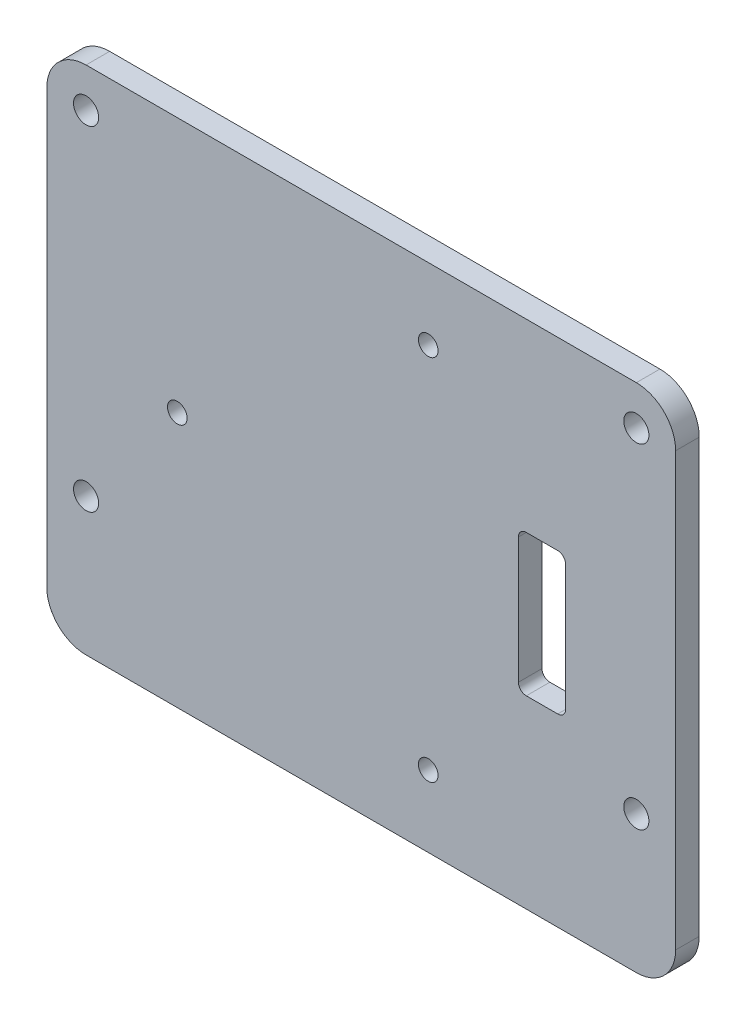
from build123d import *

# Parameters (mm, degrees)
SKETCH1_W           = 80
SKETCH1_H           = 65
SKETCH1_R           = 1.25
BOSS_EXTRUDE1_DEPTH = 3
FILLET1_R           = 5
SKETCH2_R           = 1.6
CUT_EXTRUDE1_DEPTH  = 52.626059311
SKETCH4_W           = 6
SKETCH4_H           = 18
CUT_EXTRUDE2_DEPTH  = 52.626059311
FILLET2_R           = 1


with BuildPart() as part:
    # Sketch1 → Boss-Extrude1 (new body)
    with BuildSketch(Plane.XY):
        Rectangle(SKETCH1_W, SKETCH1_H)
        with Locations((8.526833703, 23.400005474)):
            Circle(SKETCH1_R, mode=Mode.SUBTRACT)
        with Locations((8.526833703, -23.399994526)):
            Circle(SKETCH1_R, mode=Mode.SUBTRACT)
        with Locations((-23.393166297, 5.474e-06)):
            Circle(SKETCH1_R, mode=Mode.SUBTRACT)
    extrude(amount=BOSS_EXTRUDE1_DEPTH)

    # Fillet1
    fillet1_edges = [part.edges().sort_by_distance(p)[0] for p in [
        (-40, 32.5, 1.5),
        (40, 32.5, 1.5),
        (40, -32.5, 1.5),
        (-40, -32.5, 1.5),
    ]]
    fillet(fillet1_edges, radius=FILLET1_R)

    # Sketch2 → Cut-Extrude1 (cut, through all)
    with BuildSketch(Plane(origin=(0, 0, 0), x_dir=(-1, 0, 0), z_dir=(0, 0, -1))):
        with Locations((-35, 27.5)):
            Circle(SKETCH2_R)
        with Locations((-35, -15)):
            Circle(SKETCH2_R)
        with Locations((35, 27.5)):
            Circle(SKETCH2_R)
        with Locations((35, -15)):
            Circle(SKETCH2_R)
    extrude(amount=-CUT_EXTRUDE1_DEPTH, mode=Mode.SUBTRACT)

    # Sketch4 → Cut-Extrude2 (cut, through all)
    with BuildSketch(Plane(origin=(0, 0, 0), x_dir=(-1, 0, 0), z_dir=(0, 0, -1))):
        with Locations((-23, 0)):
            Rectangle(SKETCH4_W, SKETCH4_H)
    extrude(amount=-CUT_EXTRUDE2_DEPTH, mode=Mode.SUBTRACT)

    # Fillet2
    fillet2_edges = [part.edges().sort_by_distance(p)[0] for p in [
        (26, -9, 1.5),
        (26, 9, 1.5),
        (20, 9, 1.5),
        (20, -9, 1.5),
    ]]
    fillet(fillet2_edges, radius=FILLET2_R)


solid = part.part
